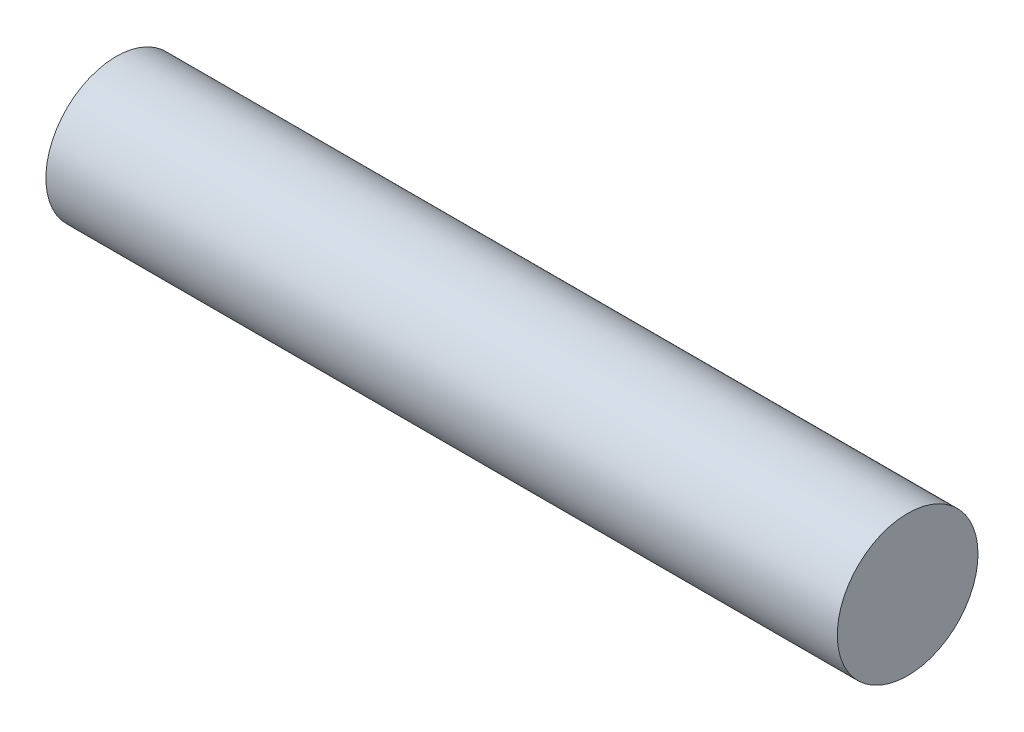
from build123d import *

# Parameters (mm, degrees)
SKETCH1_R           = 0.8
BOSS_EXTRUDE1_DEPTH = 9


with BuildPart() as part:
    # Sketch1 → Boss-Extrude1 (new body)
    with BuildSketch(Plane(origin=(0, 0, 0), x_dir=(0, 0, -1), z_dir=(1, 0, 0))):
        Circle(SKETCH1_R)
    extrude(amount=BOSS_EXTRUDE1_DEPTH)


solid = part.part
